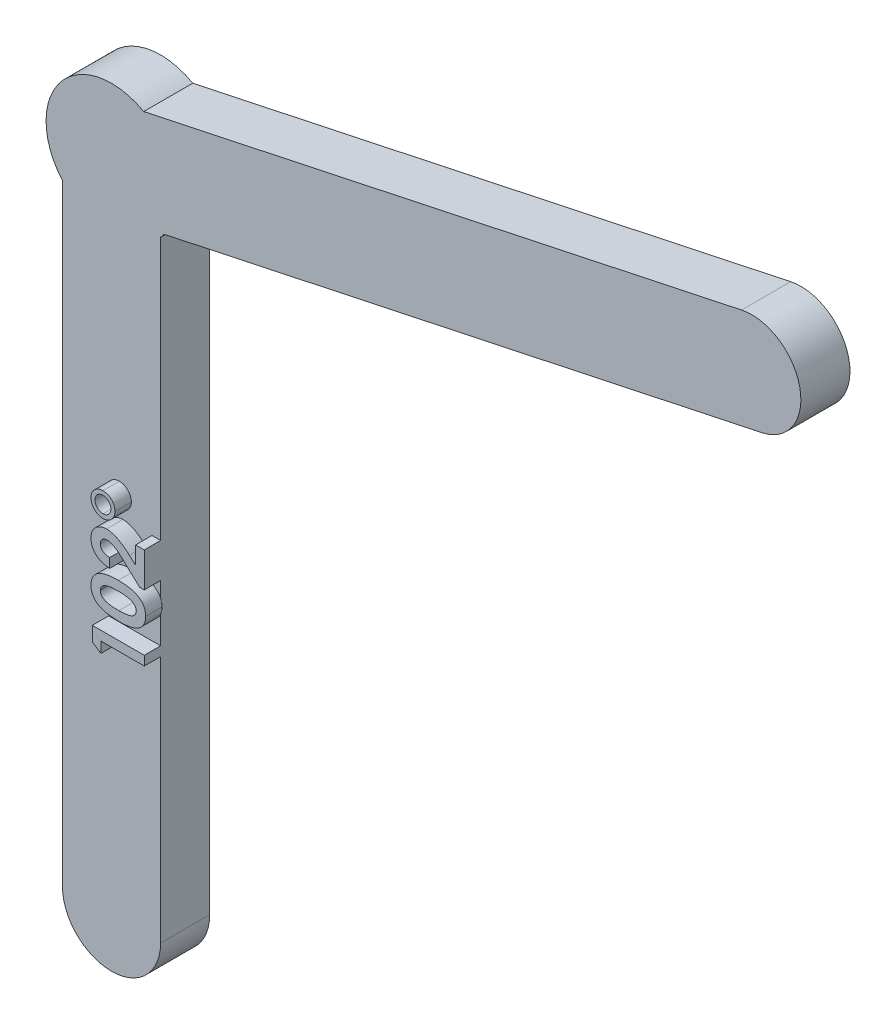
from build123d import *

# Parameters (mm, degrees)
BOSS_EXTRUDE1_DEPTH = 3
BOSS_EXTRUDE2_DEPTH = 1


with BuildPart() as part:
    # Sketch2 → Boss-Extrude1 (new body)
    with BuildSketch(Plane.XY):
        with BuildLine():
            Line((-3, -40), (-3, -2.645751311))
            ThreePointArc((-3, -2.645751311), (-3.108583846, 2.517281564), (1.964200225, 3.484525431))
            Line((1.964200225, 3.484525431), (38.502168957, 11.250910435))
            ThreePointArc((38.502168957, 11.250910435), (42.060346832, 8.940202705), (39.749639102, 5.382024831))
            Line((39.749639102, 5.382024831), (3.21167037, -2.384360174))
            ThreePointArc((3.21167037, -2.384360174), (3.108583846, -2.517281564), (3, -2.645751311))
            Line((3, -2.645751311), (3, -40))
            ThreePointArc((3, -40), (0, -43), (-3, -40))
        make_face()
    extrude(amount=BOSS_EXTRUDE1_DEPTH)

    # Sketch3 → Boss-Extrude2 (add)
    # profile 1 of 4: a face of its own
    with BuildSketch(Plane.XY.offset(3)):
        Polygon((-0.175, -25.154881865), (-0.175, -24.27399745), (3, -24.27399745), (3, -24.843869245), (0.354166667, -24.843869245), (0.354166667, -25.495151297), align=None)
    # profile 2 of 4: a face of its own
    with BuildSketch(Plane.XY.offset(3)):
        with BuildLine():
            add(Edge.make_bspline(
                [(-0.256410256, -22.187223612), (-0.256000846, -22.159639409), (-0.255195836, -22.105401495), (-0.246473924, -22.02552), (-0.233303758, -21.948569182), (-0.214913964, -21.874261296), (-0.19065475, -21.803082912), (-0.161374324, -21.734785029), (-0.126796317, -21.669429262), (-0.086761751, -21.606946387), (-0.040652473, -21.547894496), (0.010185802, -21.491318806), (0.067717809, -21.43948776), (0.130454644, -21.390835172), (0.198771401, -21.345693322), (0.272469109, -21.303770681), (0.352002612, -21.265485151), (0.437488797, -21.230380098), (0.530216664, -21.198990657), (0.631247648, -21.172550921), (0.740605462, -21.149874557), (0.858562124, -21.130734067), (0.985274483, -21.11626696), (1.120658341, -21.106515836), (1.264452704, -21.099824155), (1.363094454, -21.099278026), (1.413772035, -21.09899745)],
                knots=[0, 0, 0, 0, 0.879187688, 1.728717895, 2.558878706, 3.367146394, 4.166631857, 4.95393622, 5.734098362, 6.521634849, 7.316678452, 8.120609651, 8.943639266, 9.781961388, 10.650008082, 11.55217958, 12.483362701, 13.462505087, 14.497127373, 15.602264045, 16.790140859, 18.057036744, 19.411188506, 20.855078804, 22.384284574, 24, 24, 24, 24], degree=3))
            add(Edge.make_bspline(
                [(1.413772035, -21.09899745), (1.465083636, -21.099300727), (1.564781155, -21.099889987), (1.709890925, -21.106237126), (1.846257088, -21.117170742), (1.973869318, -21.131251658), (2.09264741, -21.150576911), (2.202741653, -21.173044562), (2.304172829, -21.200142384), (2.396949232, -21.232384739), (2.482667702, -21.267543829), (2.562361603, -21.305324879), (2.635439661, -21.347366311), (2.704216337, -21.389836589), (2.765684896, -21.437474644), (2.822263901, -21.486752984), (2.87178804, -21.540176006), (2.916848745, -21.595431785), (2.955788395, -21.654560868), (2.989844864, -21.716949245), (3.017468579, -21.783710325), (3.041494248, -21.853626861), (3.058742076, -21.927890678), (3.072427664, -22.005321711), (3.079991159, -22.086794149), (3.080929461, -22.142263866), (3.081410256, -22.170687154)],
                knots=[0, 0, 0, 0, 1.643824397, 3.193921316, 4.652018541, 6.026147715, 7.305813021, 8.506024873, 9.624771103, 10.66654028, 11.650369642, 12.592128821, 13.489360096, 14.35046321, 15.179132238, 15.977837183, 16.751455772, 17.509897991, 18.259653136, 19.016390304, 19.783391144, 20.571659993, 21.382176161, 22.223003704, 23.089447706, 24, 24, 24, 24], degree=3))
            add(Edge.make_bspline(
                [(3.081410256, -22.170687154), (3.080920089, -22.199109624), (3.079959859, -22.254788824), (3.072484978, -22.336482291), (3.058682809, -22.414321079), (3.041375575, -22.489181731), (3.017471846, -22.560488459), (2.989215292, -22.628874266), (2.954465748, -22.692986878), (2.915602853, -22.75414734), (2.870815661, -22.811389711), (2.820807888, -22.865562537), (2.766280514, -22.917423591), (2.705338818, -22.96512523), (2.639096011, -23.009520627), (2.567561271, -23.051080932), (2.490500768, -23.088961965), (2.40793533, -23.12443059), (2.317883816, -23.155810482), (2.21949947, -23.182869572), (2.112045503, -23.205788839), (1.995629446, -23.223802272), (1.870235813, -23.238328502), (1.735965212, -23.249100871), (1.592768059, -23.255486697), (1.494340976, -23.256069291), (1.443664864, -23.256369245)],
                knots=[0, 0, 0, 0, 0.917318694, 1.797013832, 2.644089644, 3.467281984, 4.274391433, 5.068665368, 5.852346333, 6.624865025, 7.405043053, 8.194438745, 9.002823433, 9.831034161, 10.688848002, 11.574933485, 12.499091769, 13.45866927, 14.473616003, 15.574277631, 16.749933499, 18.017757418, 19.374908438, 20.82337846, 22.364486432, 24, 24, 24, 24], degree=3))
            add(Edge.make_bspline(
                [(1.443664864, -23.256369245), (1.373254462, -23.255825542), (1.237396686, -23.25477646), (1.0411217, -23.241481718), (0.859699474, -23.22196841), (0.693433485, -23.193307983), (0.541707931, -23.15786976), (0.405522301, -23.112489271), (0.282992161, -23.060826886), (0.210404568, -23.016803896), (0.175445713, -22.995602018)],
                knots=[0, 0, 0, 0, 1.288568992, 2.486310467, 3.599230591, 4.627010532, 5.572937695, 6.447898582, 7.252493626, 8, 8, 8, 8], degree=3))
            add(Edge.make_bspline(
                [(0.175445713, -22.995602018), (0.141102145, -22.970949484), (0.073953702, -22.922748921), (-0.014199652, -22.838468891), (-0.089592717, -22.747920972), (-0.150519281, -22.649245361), (-0.198565973, -22.544002654), (-0.232500812, -22.431289289), (-0.252272829, -22.311521498), (-0.255010519, -22.229274958), (-0.256410256, -22.187223612)],
                knots=[0, 0, 0, 0, 1.058512271, 2.069600068, 3.047294572, 4.004278952, 4.967380941, 5.939006123, 6.946246673, 8, 8, 8, 8], degree=3))
        make_face()
        with BuildLine():
            add(Edge.make_bspline(
                [(0.313461538, -22.173231224), (0.314647089, -22.198164977), (0.316971398, -22.247048368), (0.336589396, -22.318024416), (0.367119772, -22.384663133), (0.402937146, -22.435915702), (0.437997174, -22.473843075), (0.469692245, -22.50046678), (0.505088209, -22.526130336), (0.5457633, -22.548770627), (0.590374583, -22.570366594), (0.639050565, -22.590819426), (0.692584041, -22.608406161), (0.750614615, -22.625179465), (0.814547313, -22.639686238), (0.884999784, -22.65237958), (0.962212565, -22.663193069), (1.046509296, -22.670991953), (1.137448259, -22.678152731), (1.235421604, -22.683308732), (1.340408748, -22.685459568), (1.412711585, -22.686144155), (1.45002504, -22.68649745)],
                knots=[0, 0, 0, 0, 1.076486532, 2.110485037, 3.16053299, 4.233735637, 4.798028448, 5.389657808, 6.0205397, 6.6857231, 7.399126456, 8.163539924, 8.966557062, 9.834164971, 10.774831688, 11.799768806, 12.928987201, 14.14492726, 15.459726247, 16.873396567, 18.386448164, 20, 20, 20, 20], degree=3))
            add(Edge.make_bspline(
                [(1.45002504, -22.68649745), (1.498366186, -22.685914523), (1.591063917, -22.684796717), (1.72437073, -22.678981137), (1.845884837, -22.667186388), (1.956076433, -22.652860272), (2.054303096, -22.632171296), (2.141437387, -22.608758289), (2.216697621, -22.579702468), (2.280987028, -22.546139154), (2.335677326, -22.508962718), (2.382164459, -22.468606882), (2.42242009, -22.42644467), (2.455119251, -22.381160293), (2.480178379, -22.33286173), (2.498203101, -22.281952199), (2.509236783, -22.228399345), (2.5107668, -22.191726903), (2.511538462, -22.173231224)],
                knots=[0, 0, 0, 0, 1.771738815, 3.39744054, 4.888007323, 6.245018868, 7.467093912, 8.564230264, 9.548241846, 10.417081984, 11.216594933, 11.965786359, 12.669352538, 13.348558586, 14.005353126, 14.656563323, 15.322440191, 16, 16, 16, 16], degree=3))
            add(Edge.make_bspline(
                [(2.511538462, -22.173231224), (2.511010434, -22.155370259), (2.50997662, -22.120400709), (2.499364668, -22.069407274), (2.482111937, -22.021184258), (2.457706739, -21.975877263), (2.426671795, -21.93332423), (2.388870725, -21.893733133), (2.34392674, -21.85740256), (2.310571656, -21.836236203), (2.293384415, -21.825329582)],
                knots=[0, 0, 0, 0, 0.992283464, 1.942767638, 2.88273346, 3.832339453, 4.79467288, 5.803907806, 6.868395428, 8, 8, 8, 8], degree=3))
            add(Edge.make_bspline(
                [(2.293384415, -21.825329582), (2.2698986, -21.812488872), (2.22065075, -21.785562945), (2.137546839, -21.754404216), (2.043819364, -21.728176534), (1.939176634, -21.705602752), (1.823205926, -21.690163662), (1.69664262, -21.676867537), (1.558849395, -21.670454485), (1.463385752, -21.669411367), (1.413772035, -21.668869245)],
                knots=[0, 0, 0, 0, 0.710965849, 1.490837728, 2.352621235, 3.297892224, 4.334225155, 5.461620853, 6.680770821, 8, 8, 8, 8], degree=3))
            add(Edge.make_bspline(
                [(1.413772035, -21.668869245), (1.363727648, -21.669078655), (1.267400744, -21.669481734), (1.129112143, -21.676877059), (1.002808457, -21.687175614), (0.88877167, -21.702239428), (0.786724952, -21.721621762), (0.696674974, -21.745510562), (0.618444263, -21.77367368), (0.552110828, -21.807071781), (0.495736507, -21.844062254), (0.447371712, -21.883328769), (0.406079071, -21.925037363), (0.371703192, -21.969118285), (0.345437441, -22.016591802), (0.326891649, -22.06655111), (0.315672066, -22.119098628), (0.314208327, -22.154943475), (0.313461538, -22.173231224)],
                knots=[0, 0, 0, 0, 1.793836731, 3.452829483, 4.963243077, 6.335886805, 7.574563692, 8.684454726, 9.672768357, 10.54971625, 11.340229787, 12.085688095, 12.778991901, 13.440269426, 14.083255152, 14.715733572, 15.344777694, 16, 16, 16, 16], degree=3))
        make_face(mode=Mode.SUBTRACT)
    # profile 3 of 4: a face of its own
    with BuildSketch(Plane.XY.offset(3)):
        with BuildLine():
            Line((0.883333333, -20.162779502), (0.883333333, -20.732651297))
            add(Edge.make_bspline(
                [(0.883333333, -20.732651297), (0.840225096, -20.730191074), (0.755994188, -20.725383947), (0.633653662, -20.706241436), (0.518027034, -20.680657038), (0.40946192, -20.646219807), (0.307912712, -20.60380263), (0.213715784, -20.552349795), (0.126196171, -20.493397498), (0.046888793, -20.425757446), (-0.024410951, -20.352174821), (-0.086743059, -20.272838264), (-0.138923185, -20.187973141), (-0.181726781, -20.098146926), (-0.21597517, -20.003712445), (-0.238860935, -19.903715573), (-0.254362753, -19.79903865), (-0.255719005, -19.727378184), (-0.256410256, -19.690854422)],
                knots=[0, 0, 0, 0, 1.198928049, 2.342633425, 3.435730849, 4.486331048, 5.502589352, 6.488331875, 7.46361919, 8.428949135, 9.378681775, 10.305958057, 11.226249248, 12.140413166, 13.066341608, 14.010670971, 14.986082777, 16, 16, 16, 16], degree=3))
            add(Edge.make_bspline(
                [(-0.256410256, -19.690854422), (-0.255105406, -19.646001889), (-0.252556912, -19.558400759), (-0.227944491, -19.43153247), (-0.1902546, -19.312410398), (-0.135496388, -19.202301662), (-0.066445841, -19.101397701), (0.016045912, -19.010259508), (0.112981004, -18.930664566), (0.22156795, -18.863233626), (0.336775889, -18.807471791), (0.455688105, -18.768021196), (0.575235528, -18.742227374), (0.655723183, -18.739469888), (0.695708133, -18.738100015)],
                knots=[0, 0, 0, 0, 1.075374184, 2.100304875, 3.089917907, 4.066149699, 5.039978333, 6.01615708, 7.006437042, 8.039858286, 9.077679641, 10.07047942, 11.041445745, 12, 12, 12, 12], degree=3))
            add(Edge.make_bspline(
                [(0.695708133, -18.738100015), (0.719894323, -18.738632687), (0.76857515, -18.739704825), (0.842241189, -18.747159544), (0.91727866, -18.758343098), (0.993623236, -18.77520516), (1.071296278, -18.796233582), (1.15053039, -18.821743906), (1.23087573, -18.852328775), (1.313238994, -18.887474255), (1.397877871, -18.929414737), (1.48610119, -18.978199927), (1.57781503, -19.035460826), (1.673918976, -19.099333418), (1.77294563, -19.172330469), (1.875994606, -19.252518354), (1.982903527, -19.34030072), (2.054398515, -19.402554777), (2.091130809, -19.434539317)],
                knots=[0, 0, 0, 0, 0.728277616, 1.465842947, 2.227925269, 3.011838508, 3.818735656, 4.650581052, 5.517389122, 6.406849312, 7.346234817, 8.360743166, 9.441530624, 10.601362564, 11.834937575, 13.145232671, 14.533293658, 16, 16, 16, 16], degree=3))
            Line((2.091130809, -19.434539317), (2.470833333, -19.765904502))
            Line((2.470833333, -19.765904502), (2.470833333, -18.697394886))
            Line((2.470833333, -18.697394886), (3, -18.697394886))
            Line((3, -18.697394886), (3, -20.814061553))
            Line((3, -20.814061553), (2.711247997, -20.814061553))
            Line((2.711247997, -20.814061553), (1.710792268, -19.874027498))
            add(Edge.make_bspline(
                [(1.710792268, -19.874027498), (1.681608954, -19.846810666), (1.625089529, -19.794099733), (1.542079999, -19.719104506), (1.46332294, -19.651215475), (1.38790503, -19.591950629), (1.318379822, -19.537724275), (1.252118997, -19.492359941), (1.190988578, -19.452853164), (1.116473028, -19.411584162), (1.028271209, -19.371490235), (0.9267219, -19.334724743), (0.829596088, -19.312538281), (0.766193513, -19.309452269), (0.735777244, -19.307971809)],
                knots=[0, 0, 0, 0, 1.246192343, 2.413505005, 3.49357156, 4.492416076, 5.408771964, 6.246246772, 6.999304986, 7.680960093, 8.904522682, 10.020616941, 11.0504258, 12, 12, 12, 12], degree=3))
            add(Edge.make_bspline(
                [(0.735777244, -19.307971809), (0.706350798, -19.309075792), (0.649332342, -19.311214936), (0.568223891, -19.334722394), (0.494788469, -19.371140964), (0.431220409, -19.422459871), (0.378982318, -19.484623141), (0.340129094, -19.556458639), (0.317710962, -19.637380694), (0.314905012, -19.694108596), (0.313461538, -19.723291321)],
                knots=[0, 0, 0, 0, 1.062038974, 2.057870785, 3.028805853, 4.01125022, 4.991535629, 5.949134679, 6.94496649, 8, 8, 8, 8], degree=3))
            add(Edge.make_bspline(
                [(0.313461538, -19.723291321), (0.313994775, -19.738367488), (0.315044537, -19.768047344), (0.322032517, -19.811674413), (0.334348102, -19.853188704), (0.350849253, -19.893052293), (0.372721647, -19.930839746), (0.399682857, -19.966455751), (0.431047738, -20.000275568), (0.466718216, -20.032144085), (0.50652648, -20.061148596), (0.550108963, -20.086910297), (0.597438611, -20.108210934), (0.647890602, -20.12696479), (0.70200683, -20.141428661), (0.759463417, -20.151960153), (0.820166887, -20.159966543), (0.861894815, -20.161824791), (0.883333333, -20.162779502)],
                knots=[0, 0, 0, 0, 0.903469896, 1.778625579, 2.63899355, 3.493148037, 4.358286772, 5.247621495, 6.164656832, 7.118446693, 8.109501108, 9.111810964, 10.146451449, 11.215617525, 12.33435995, 13.498009769, 14.714554818, 16, 16, 16, 16], degree=3))
        make_face()
    # profile 4 of 4: a face of its own
    with BuildSketch(Plane.XY.offset(3)):
        with BuildLine():
            add(Edge.make_bspline(
                [(0.476282051, -16.824958989), (0.501543872, -16.825505484), (0.55122174, -16.826580176), (0.624352745, -16.837013476), (0.694208258, -16.854492691), (0.761803607, -16.876903338), (0.825395964, -16.908042089), (0.886396731, -16.944903837), (0.943669883, -16.989402672), (0.9978957, -17.039014969), (1.047295391, -17.093515132), (1.090947065, -17.151405488), (1.127096601, -17.212864468), (1.157366856, -17.276577248), (1.180332148, -17.343408663), (1.196689885, -17.412864586), (1.20741609, -17.485236986), (1.208449037, -17.534503871), (1.208974359, -17.559559349)],
                knots=[0, 0, 0, 0, 1.048753193, 2.062393874, 3.059725798, 4.03711221, 5.013824111, 5.993903926, 6.992478922, 8.020738441, 9.043061753, 10.043343452, 11.026424807, 11.999358773, 12.968420071, 13.955122655, 14.960044262, 16, 16, 16, 16], degree=3))
            add(Edge.make_bspline(
                [(1.208974359, -17.559559349), (1.208454225, -17.584616682), (1.207431478, -17.633887214), (1.196631189, -17.706233128), (1.180530583, -17.775855144), (1.156529218, -17.842391691), (1.126678292, -17.90615653), (1.090260147, -17.967072817), (1.046482503, -18.024600993), (0.996781055, -18.078582797), (0.942375086, -18.128107638), (0.88420218, -18.171482912), (0.823225465, -18.208946116), (0.758107997, -18.237837437), (0.69067286, -18.261947038), (0.619758864, -18.27798784), (0.545943315, -18.288833106), (0.495615647, -18.289833085), (0.469921875, -18.290343604)],
                knots=[0, 0, 0, 0, 1.037227242, 2.039512271, 3.023626077, 3.993053151, 4.963434463, 5.936395473, 6.927031705, 7.952593414, 8.972234493, 9.969891786, 10.954906455, 11.929570282, 12.915563215, 13.916770353, 14.936449251, 16, 16, 16, 16], degree=3))
            add(Edge.make_bspline(
                [(0.469921875, -18.290343604), (0.445290866, -18.289811451), (0.396869022, -18.288765297), (0.325492116, -18.278103661), (0.256787066, -18.261182775), (0.190979117, -18.23681523), (0.128167681, -18.205730248), (0.067236284, -18.169180135), (0.010175979, -18.123937412), (-0.044275745, -18.073515722), (-0.093962638, -18.018218509), (-0.137555056, -17.95952238), (-0.173973759, -17.89802202), (-0.203993097, -17.834134423), (-0.227847104, -17.767768562), (-0.244158222, -17.698411219), (-0.254789074, -17.626671533), (-0.255866772, -17.577830012), (-0.256410256, -17.553199173)],
                knots=[0, 0, 0, 0, 1.027628768, 2.020204677, 3.0054932, 3.977172113, 4.942988595, 5.928118098, 6.937247537, 7.976812879, 9.023474825, 10.036014018, 11.024160528, 12.002107364, 12.979092523, 13.962271943, 14.972371232, 16, 16, 16, 16], degree=3))
            add(Edge.make_bspline(
                [(-0.256410256, -17.553199173), (-0.255881051, -17.528566172), (-0.254836181, -17.479930408), (-0.244068832, -17.408427146), (-0.227959354, -17.339440503), (-0.203981879, -17.27352423), (-0.173948227, -17.210285117), (-0.137706982, -17.149501332), (-0.093944483, -17.091941849), (-0.043999627, -17.038019265), (0.009956511, -16.987787182), (0.068273488, -16.944627592), (0.128824771, -16.907104674), (0.192846684, -16.877455064), (0.259342082, -16.853394895), (0.329176204, -16.837233977), (0.401748506, -16.826543556), (0.451226198, -16.825491671), (0.476282051, -16.824958989)],
                knots=[0, 0, 0, 0, 1.02774298, 2.029191086, 3.012479778, 3.981238486, 4.951290381, 5.931946007, 6.930416638, 7.964088953, 8.997761269, 10.003308488, 10.98854748, 11.966603007, 12.943696749, 13.935593372, 14.954569896, 16, 16, 16, 16], degree=3))
        make_face()
        with BuildLine():
            add(Edge.make_bspline(
                [(0.479462139, -17.069189758), (0.462471258, -17.069424264), (0.428972226, -17.069886612), (0.379883793, -17.077505977), (0.332524379, -17.088023775), (0.287283463, -17.10328392), (0.24427911, -17.123234284), (0.203398935, -17.147571829), (0.164484674, -17.176174899), (0.128492582, -17.209237523), (0.095853701, -17.245103846), (0.066652511, -17.282897251), (0.042455186, -17.323086522), (0.023016589, -17.365273093), (0.006315159, -17.408801858), (-0.003707976, -17.454711924), (-0.01154919, -17.502263298), (-0.011966436, -17.534718897), (-0.012179487, -17.55129112)],
                knots=[0, 0, 0, 0, 1.061159961, 2.092171217, 3.098605391, 4.092036902, 5.070589041, 6.057187883, 7.061962211, 8.084674938, 9.107387665, 10.090954379, 11.06617917, 12.032717429, 12.99305519, 13.973669989, 14.965331307, 16, 16, 16, 16], degree=3))
            add(Edge.make_bspline(
                [(-0.012179487, -17.55129112), (-0.01157068, -17.568051412), (-0.01036426, -17.601263796), (-0.004409395, -17.650200831), (0.007572839, -17.69685371), (0.022606002, -17.742054962), (0.043122897, -17.784898142), (0.067542797, -17.826391236), (0.096744971, -17.865435361), (0.129769422, -17.902214665), (0.165718261, -17.935960463), (0.204573602, -17.964950546), (0.244977971, -17.990352408), (0.287582445, -18.010455361), (0.331832846, -18.026567734), (0.377821945, -18.038209426), (0.425871214, -18.044356322), (0.458458137, -18.045521173), (0.475010016, -18.046112835)],
                knots=[0, 0, 0, 0, 1.042034071, 2.064906527, 3.055369705, 4.030203466, 5.020228521, 6.000742353, 7.017744738, 8.043920206, 9.069249762, 10.075703201, 11.051782302, 12.029903876, 12.99669358, 13.974371501, 14.971122288, 16, 16, 16, 16], degree=3))
            add(Edge.make_bspline(
                [(0.475010016, -18.046112835), (0.491349767, -18.045520146), (0.523514051, -18.044353455), (0.570936909, -18.038223162), (0.616468237, -18.026465839), (0.660506807, -18.010425399), (0.703332854, -17.990458383), (0.743356347, -17.964229259), (0.782721478, -17.935019181), (0.819574977, -17.900938323), (0.853594861, -17.864058718), (0.883277913, -17.824563201), (0.908722399, -17.783622403), (0.929101491, -17.740636346), (0.945194342, -17.696373754), (0.956841315, -17.650387952), (0.962986781, -17.60233779), (0.964151827, -17.56975099), (0.96474359, -17.553199173)],
                knots=[0, 0, 0, 0, 1.017878107, 2.003660885, 2.970612419, 3.939454555, 4.919652619, 5.904816436, 6.913406512, 7.969270601, 9.02513469, 10.033724766, 11.041277553, 12.021475617, 12.990317753, 13.970071221, 14.968938047, 16, 16, 16, 16], degree=3))
            add(Edge.make_bspline(
                [(0.96474359, -17.553199173), (0.964515736, -17.536840687), (0.964066668, -17.504600367), (0.956359019, -17.457448889), (0.946146284, -17.411789288), (0.929505189, -17.368485652), (0.910263551, -17.326033898), (0.884925795, -17.286252494), (0.856415485, -17.247396305), (0.822504018, -17.212069657), (0.787116244, -17.177952839), (0.747777121, -17.149765554), (0.707718654, -17.124520148), (0.665616684, -17.10387006), (0.621397497, -17.089062601), (0.575848465, -17.07693948), (0.528165265, -17.071009446), (0.49579822, -17.069800121), (0.479462139, -17.069189758)],
                knots=[0, 0, 0, 0, 1.029744634, 2.029484694, 3.00508751, 3.97324883, 4.947661161, 5.937798898, 6.940036528, 7.980134083, 9.020231638, 10.033191535, 11.023329272, 12.003497406, 12.979740652, 13.958541426, 14.969648588, 16, 16, 16, 16], degree=3))
        make_face(mode=Mode.SUBTRACT)
    extrude(amount=BOSS_EXTRUDE2_DEPTH)


solid = part.part
